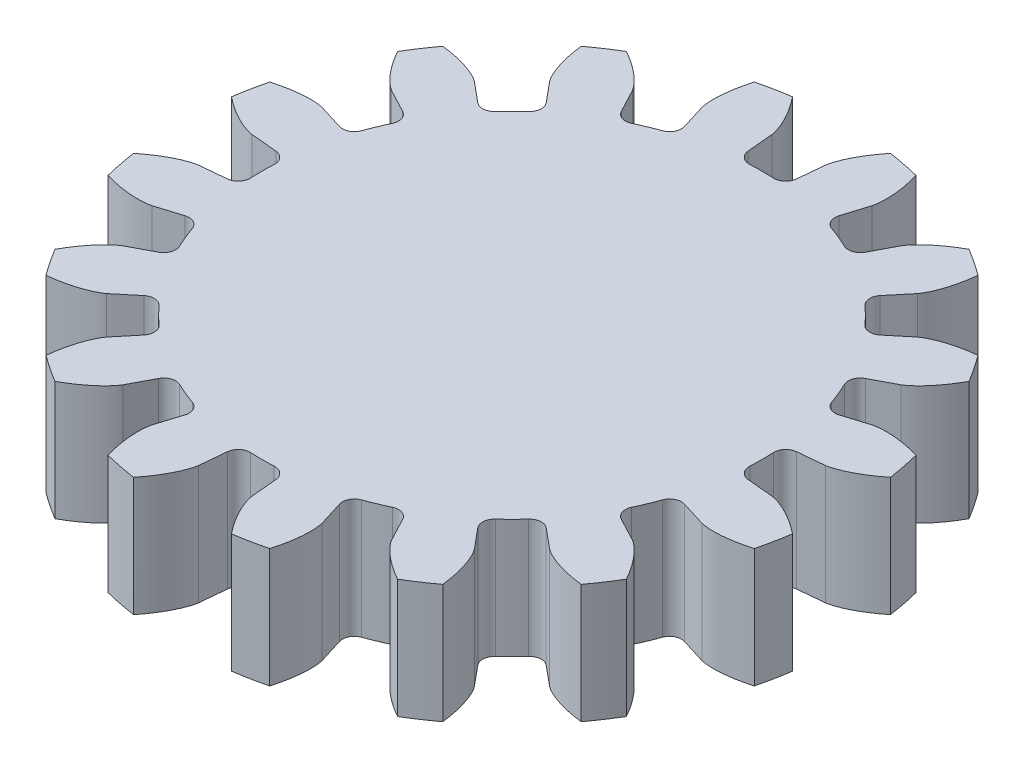
from build123d import *

# Parameters (mm, degrees)
SKETCH1_R                = 7.112
BOSS_EXTRUDE1_DEPTH      = 2.54
CUT_EXTRUDE1_START       = -2.54
CUT_EXTRUDE1_DEPTH       = 2.54
FILLET1_R                = 0.254
CIRPATTERN1_COUNT        = 16
FILLET1_OF_CIRPATTERN1_R = 0.254


with BuildPart() as part:
    # Sketch1 → Boss-Extrude1 (new body)
    with BuildSketch(Plane(origin=(0, 0, 0), x_dir=(1, 0, 0), z_dir=(0, 1, 0))):
        with Locations(Location((0, 0, 0), (0, 0, 270))):
            Circle(SKETCH1_R)
    extrude(amount=BOSS_EXTRUDE1_DEPTH)

    # Sketch2 → Cut-Extrude1 (cut)
    with BuildSketch(Plane(origin=(0, 2.54, 0), x_dir=(1, 0, 0), z_dir=(0, 1, 0)).offset(CUT_EXTRUDE1_START)):
        with BuildLine():
            add(Edge.make_bspline(
                [(6.121381643, 0.568650467), (6.125823476, 0.569119257), (6.134187344, 0.570327824), (6.147793057, 0.572647858), (6.174518051, 0.578115258), (6.204540912, 0.585507595), (6.238251635, 0.595050295), (6.274090651, 0.606440795), (6.296905537, 0.614269825), (6.311987295, 0.619684), (6.31942299, 0.622409087)],
                knots=[0, 0, 0, 0, 0, 0.015083688, 0.02853182, 0.04661014, 0.092110526, 0.119476176, 0.146842496, 0.173585809, 0.173585809, 0.173585809, 0.173585809, 0.173585809], degree=4))
            Line((6.121381643, 0.568650467), (6.06986593, 0.563864875))
            ThreePointArc((6.06986593, 0.563864875), (6.089462977, 0.282235091), (6.096, 0))
            ThreePointArc((6.096, 0), (6.089462977, -0.282235091), (6.06986593, -0.563864875))
            Line((6.06986593, -0.563864875), (6.121381643, -0.568650467))
            add(Edge.make_bspline(
                [(6.121381643, -0.568650467), (6.125823476, -0.569119257), (6.134187344, -0.570327824), (6.147793057, -0.572647858), (6.174518051, -0.578115258), (6.204540912, -0.585507595), (6.238251635, -0.595050295), (6.274090651, -0.606440795), (6.296905537, -0.614269825), (6.311987295, -0.619684), (6.31942299, -0.622409087)],
                knots=[0, 0, 0, 0, 0, 0.015083688, 0.02853182, 0.04661014, 0.092110526, 0.119476176, 0.146842496, 0.173585809, 0.173585809, 0.173585809, 0.173585809, 0.173585809], degree=4))
            ThreePointArc((6.31942299, -0.622409087), (6.342351141, -0.311579855), (6.35, 0))
            ThreePointArc((6.35, 0), (6.342351141, 0.311579855), (6.31942299, 0.622409087))
        make_face()
        with BuildLine():
            ThreePointArc((6.096, 0), (6.089462977, 0.282235091), (6.06986593, 0.563864875))
            Line((6.06986593, 0.563864875), (5.311132688, 0.493381766))
            ThreePointArc((5.311132688, 0.493381766), (5.328280105, 0.246955705), (5.334, 0))
            ThreePointArc((5.334, 0), (5.328280105, -0.246955705), (5.311132688, -0.493381766))
            Line((5.311132688, -0.493381766), (6.06986593, -0.563864875))
            ThreePointArc((6.06986593, -0.563864875), (6.089462977, -0.282235091), (6.096, 0))
        make_face()
        with BuildLine():
            add(Edge.make_bspline(
                [(6.31942299, 0.622409087), (6.319596221, 0.622472574), (6.32737786, 0.625325808), (6.342728068, 0.631075106), (6.365540737, 0.639958788), (6.401944984, 0.654924711), (6.445365406, 0.673878177), (6.495758303, 0.697493935), (6.55247163, 0.725998466), (6.609773323, 0.756879235), (6.665738733, 0.788766386), (6.721774612, 0.822698255), (6.775629273, 0.856743091), (6.831013431, 0.893847014), (6.881855933, 0.928982871), (6.938174315, 0.970260914), (6.97659637, 0.999012689), (7.011514253, 1.026418371), (7.029804463, 1.040957522), (7.034814214, 1.044955969)],
                knots=[0.173585809, 0.173585809, 0.173585809, 0.173585809, 0.173585809, 0.174208854, 0.201574956, 0.228941013, 0.256307345, 0.307035032, 0.361767352, 0.416499661, 0.471231937, 0.525964282, 0.580696616, 0.635428982, 0.690161387, 0.744893688, 0.799626082, 0.854358407, 0.875998661, 0.875998661, 0.875998661, 0.875998661, 0.875998661], degree=4))
            ThreePointArc((6.31942299, 0.622409087), (6.342351141, 0.311579855), (6.35, 0))
            ThreePointArc((6.35, 0), (6.342351141, -0.311579855), (6.31942299, -0.622409087))
            add(Edge.make_bspline(
                [(6.31942299, -0.622409087), (6.319596221, -0.622472574), (6.32737786, -0.625325808), (6.342728068, -0.631075106), (6.365540737, -0.639958788), (6.401944984, -0.654924711), (6.445365406, -0.673878177), (6.495758303, -0.697493935), (6.55247163, -0.725998466), (6.609773323, -0.756879235), (6.665738733, -0.788766386), (6.721774612, -0.822698255), (6.775629273, -0.856743091), (6.831013431, -0.893847014), (6.881855933, -0.928982871), (6.938174315, -0.970260914), (6.97659637, -0.999012689), (7.011514253, -1.026418371), (7.029804463, -1.040957522), (7.034814214, -1.044955969)],
                knots=[0.173585809, 0.173585809, 0.173585809, 0.173585809, 0.173585809, 0.174208854, 0.201574956, 0.228941013, 0.256307345, 0.307035032, 0.361767352, 0.416499661, 0.471231937, 0.525964282, 0.580696616, 0.635428982, 0.690161387, 0.744893688, 0.799626082, 0.854358407, 0.875998661, 0.875998661, 0.875998661, 0.875998661, 0.875998661], degree=4))
            ThreePointArc((7.034814214, -1.044955969), (7.092677304, -0.52390138), (7.112, 0))
            ThreePointArc((7.112, 0), (7.092677304, 0.52390138), (7.034814214, 1.044955969))
        make_face()
    cut_extrude1 = extrude(amount=CUT_EXTRUDE1_DEPTH, mode=Mode.SUBTRACT)

    # Fillet1
    fillet1_edges = [part.edges().sort_by_distance(p)[0] for p in [
        (5.311132688, 1.27, 0.493381766),
        (5.311132688, 1.27, -0.493381766),
    ]]
    fillet(fillet1_edges, radius=FILLET1_R)

    # CirPattern1: Cut-Extrude1 ×16 about axis
    cirpattern1_axis = Axis((0, 2.54, 0), (0, 1, 0))
    for i in range(1, CIRPATTERN1_COUNT):
        add(cut_extrude1.rotate(cirpattern1_axis, i * 360 / CIRPATTERN1_COUNT), mode=Mode.SUBTRACT)

    # Fillet1 of CirPattern1
    fillet1_of_cirpattern1_edges = [part.edges().sort_by_distance(p)[0] for p in [
        (5.095655813, 1.27, -1.576657172),
        (4.718037757, 1.27, -2.488307802),
        (4.104411532, 1.27, -3.406664347),
        (3.406664347, 1.27, -4.104411532),
        (2.488307802, 1.27, -4.718037757),
        (1.576657172, 1.27, -5.095655813),
        (0.493381766, 1.27, -5.311132688),
        (-0.493381766, 1.27, -5.311132688),
        (-1.576657172, 1.27, -5.095655813),
        (-2.488307802, 1.27, -4.718037757),
        (-3.406664347, 1.27, -4.104411532),
        (-4.104411532, 1.27, -3.406664347),
        (-4.718037757, 1.27, -2.488307802),
        (-5.095655813, 1.27, -1.576657172),
        (-5.311132688, 1.27, -0.493381766),
        (-5.311132688, 1.27, 0.493381766),
        (-5.095655813, 1.27, 1.576657172),
        (-4.718037757, 1.27, 2.488307802),
        (-4.104411532, 1.27, 3.406664347),
        (-3.406664347, 1.27, 4.104411532),
        (-2.488307802, 1.27, 4.718037757),
        (-1.576657172, 1.27, 5.095655813),
        (-0.493381766, 1.27, 5.311132688),
        (0.493381766, 1.27, 5.311132688),
        (1.576657172, 1.27, 5.095655813),
        (2.488307802, 1.27, 4.718037757),
        (3.406664347, 1.27, 4.104411532),
        (4.104411532, 1.27, 3.406664347),
        (4.718037757, 1.27, 2.488307802),
        (5.095655813, 1.27, 1.576657172),
    ]]
    fillet(fillet1_of_cirpattern1_edges, radius=FILLET1_OF_CIRPATTERN1_R)


solid = part.part
